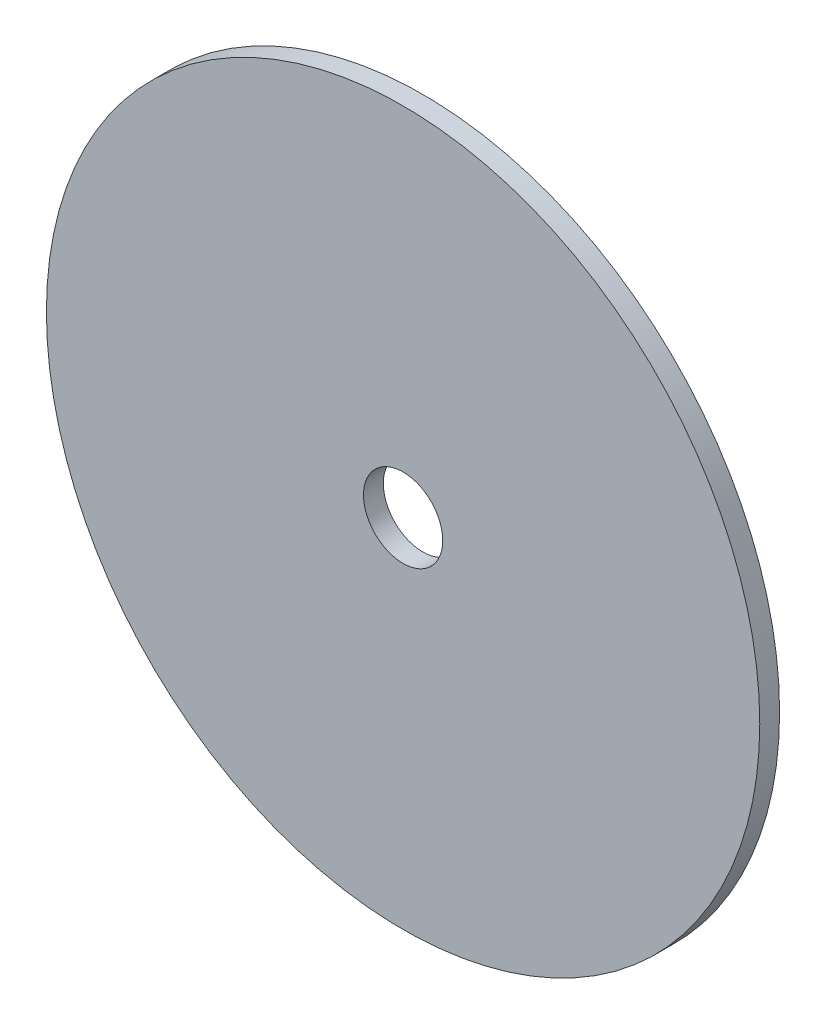
from build123d import *

# Parameters (mm, degrees)
SKETCH1_R           = 114.3
BOSS_EXTRUDE1_DEPTH = 6.35
SKETCH2_R           = 12.7
CUT_EXTRUDE1_DEPTH  = 6.35


with BuildPart() as part:
    # Sketch1 → Boss-Extrude1 (new body)
    with BuildSketch(Plane.XY):
        Circle(SKETCH1_R)
    extrude(amount=BOSS_EXTRUDE1_DEPTH)

    # Sketch2 → Cut-Extrude1 (cut)
    with BuildSketch(Plane.XY.offset(6.35)):
        Circle(SKETCH2_R)
    extrude(amount=-CUT_EXTRUDE1_DEPTH, mode=Mode.SUBTRACT)


solid = part.part
